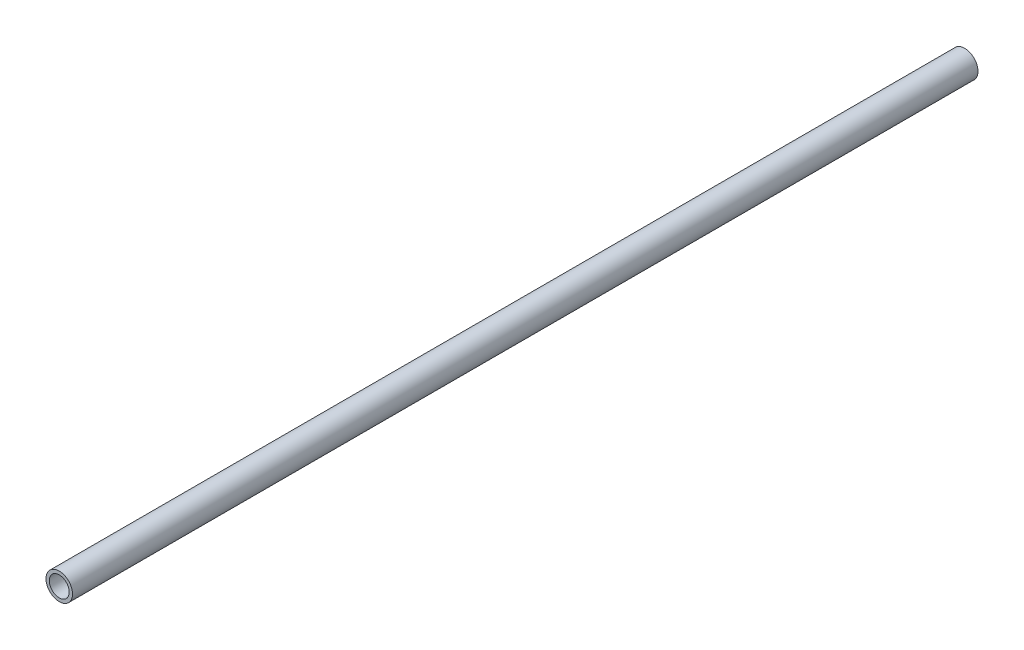
from build123d import *

# Parameters (mm, degrees)
SKETCH1_R           = 2
SKETCH1_R_2         = 1.5
BOSS_EXTRUDE1_DEPTH = 136.398


with BuildPart() as part:
    # Sketch1 → Boss-Extrude1 (new body)
    with BuildSketch(Plane.XY):
        Circle(SKETCH1_R)
        Circle(SKETCH1_R_2, mode=Mode.SUBTRACT)
    extrude(amount=BOSS_EXTRUDE1_DEPTH)


solid = part.part
